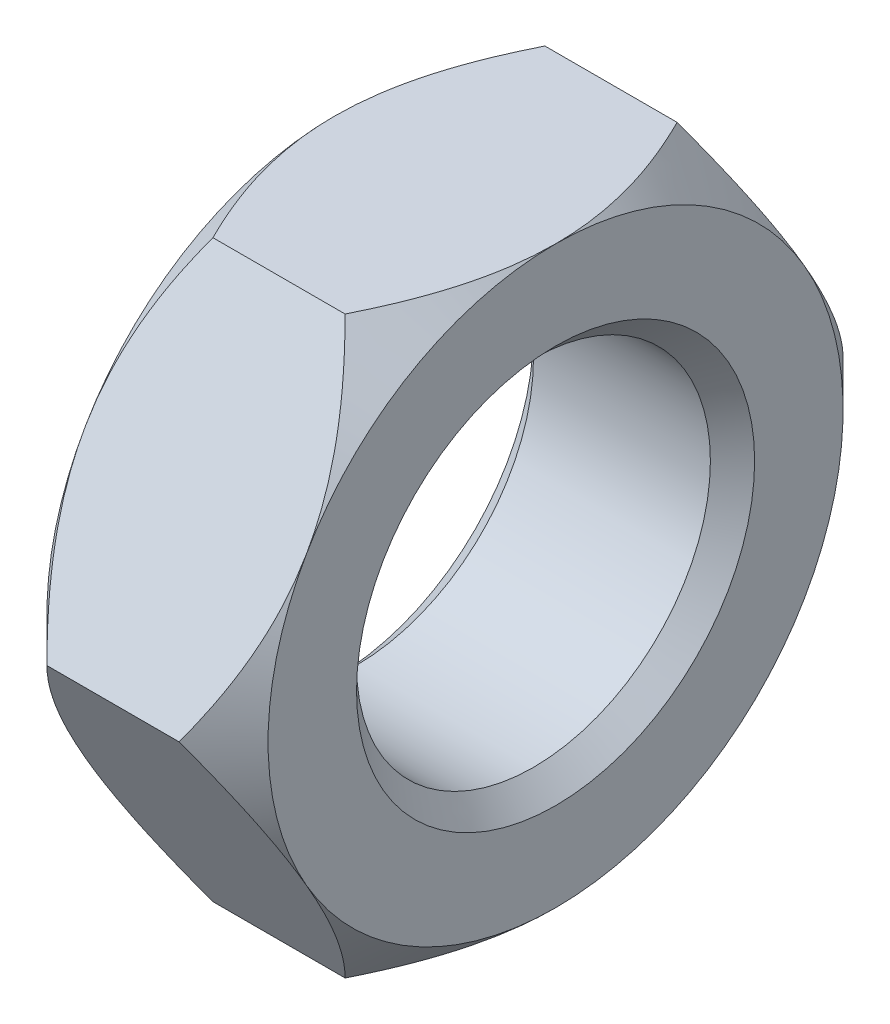
from build123d import *

# Parameters (mm, degrees)
EXTRUDE_1_DEPTH     = 10
SKETCH_2_R          = 8
CUT_EXTRUDE_1_DEPTH = 20
CHAMFER_1_SIZE      = 1
SKETCH_3_OUTSIDE_W  = 130.214
SKETCH_3_OUTSIDE_H  = 126.192
SKETCH_3_OUTSIDE_R  = 13
CUT_EXTRUDE_2_DEPTH = 45
CUT_EXTRUDE_2_DRAFT = -45
SKETCH_4_OUTSIDE_W  = 130.214
SKETCH_4_OUTSIDE_H  = 126.192
SKETCH_4_OUTSIDE_R  = 13
CUT_EXTRUDE_3_DEPTH = 45
CUT_EXTRUDE_3_DRAFT = -45


with BuildPart() as part:
    # 草图1 → 凸台-拉伸1 (new body)
    with BuildSketch(Plane(origin=(0, 0, 0), x_dir=(0, 0, -1), z_dir=(1, 0, 0))):
        Polygon((-7.505553499, -13), (7.505553499, -13), (15.011106999, 0), (7.505553499, 13), (-7.505553499, 13), (-15.011106999, 0), align=None)
    extrude(amount=EXTRUDE_1_DEPTH)

    # 草图2 → 切除-拉伸1 (cut)
    with BuildSketch(Plane(origin=(10, 0, 0), x_dir=(0, 0, -1), z_dir=(1, 0, 0))):
        Circle(SKETCH_2_R)
    extrude(amount=-CUT_EXTRUDE_1_DEPTH, mode=Mode.SUBTRACT)

    # 倒角1
    chamfer_1_edges = [part.edges().sort_by_distance(p)[0] for p in [
        (0, 0, 8),
        (10, 0, 8),
    ]]
    chamfer(chamfer_1_edges, length=CHAMFER_1_SIZE)


with BuildPart() as cut_extrude_2_tool:
    # 草图3 outside → 切除-拉伸2 (with draft: the straight prism first)
    with BuildSketch(Plane(origin=(10, 0, 0), x_dir=(0, 0, -1), z_dir=(1, 0, 0))):
        Rectangle(SKETCH_3_OUTSIDE_W, SKETCH_3_OUTSIDE_H)
        Circle(SKETCH_3_OUTSIDE_R, mode=Mode.SUBTRACT)
    extrude(amount=-CUT_EXTRUDE_2_DEPTH)
    # 切除-拉伸2: the draft: its side faces are tilted about the plane it starts from
    cut_extrude_2_sides = [cut_extrude_2_tool.faces().sort_by_distance(p)[0] for p in [
        (-12.5, -63.096, 0),
        (-12.5, 0, -65.107),
        (-12.5, 63.096, 0),
        (-12.5, 0, 65.107),
        (-12.5, 0, 13),
    ]]
    draft(cut_extrude_2_sides, Plane(origin=(10, 0, 0), x_dir=(0, 0, -1), z_dir=(1, 0, 0)), CUT_EXTRUDE_2_DRAFT)


with BuildPart() as part_1:
    add(part.part)

    # 切除-拉伸2: cut by cut_extrude_2_tool
    add(cut_extrude_2_tool.part, mode=Mode.SUBTRACT)


with BuildPart() as cut_extrude_3_tool:
    # 草图4 outside → 切除-拉伸3 (with draft: the straight prism first)
    with BuildSketch(Plane.ZY):
        Rectangle(SKETCH_4_OUTSIDE_W, SKETCH_4_OUTSIDE_H)
        Circle(SKETCH_4_OUTSIDE_R, mode=Mode.SUBTRACT)
    extrude(amount=-CUT_EXTRUDE_3_DEPTH)
    # 切除-拉伸3: the draft: its side faces are tilted about the plane it starts from
    cut_extrude_3_sides = [cut_extrude_3_tool.faces().sort_by_distance(p)[0] for p in [
        (22.5, -63.096, 0),
        (22.5, 0, 65.107),
        (22.5, 63.096, 0),
        (22.5, 0, -65.107),
        (22.5, 0, -13),
    ]]
    draft(cut_extrude_3_sides, Plane.ZY, CUT_EXTRUDE_3_DRAFT)


with BuildPart() as part_2:
    add(part_1.part)

    # 切除-拉伸3: cut by cut_extrude_3_tool
    add(cut_extrude_3_tool.part, mode=Mode.SUBTRACT)


solid = part_2.part
